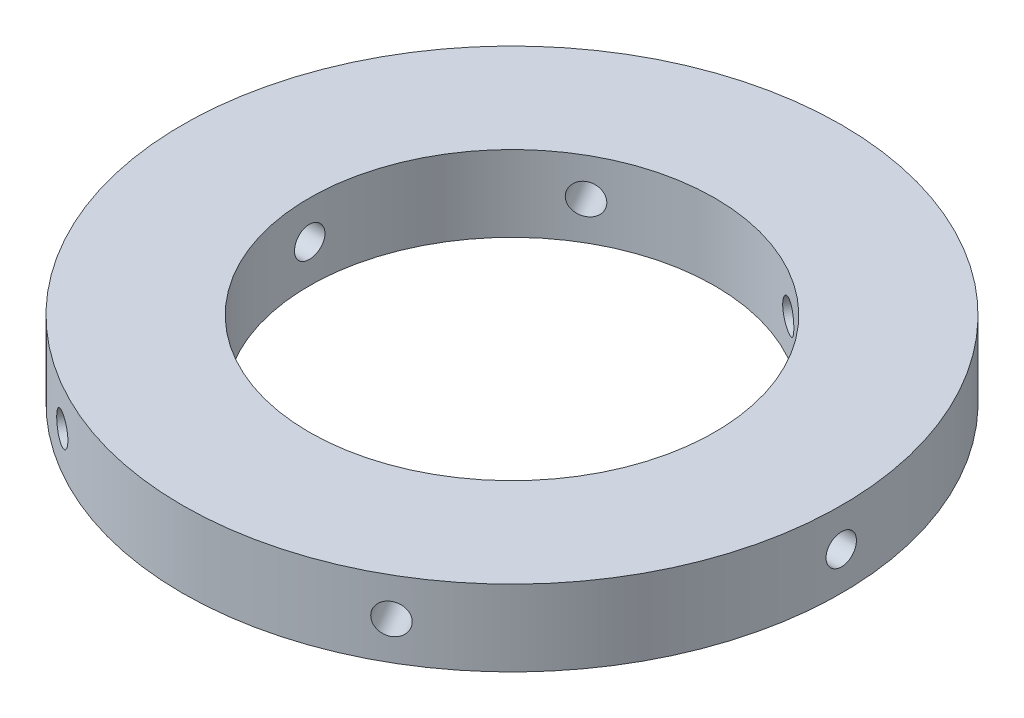
from build123d import *

# Parameters (mm, degrees)
SKETCH1_R           = 65
SKETCH1_R_2         = 40
BOSS_EXTRUDE1_DEPTH = 15
SKETCH2_R           = 3
CUT_EXTRUDE1_DEPTH  = 94.139680051
CIRPATTERN1_COUNT   = 6


with BuildPart() as part:
    # Sketch1 → Boss-Extrude1 (new body)
    with BuildSketch(Plane(origin=(0, 0, 0), x_dir=(1, 0, 0), z_dir=(0, 1, 0))):
        with Locations(Location((0, 0, 0), (0, 0, 270))):
            Circle(SKETCH1_R)
        with Locations(Location((0, 0, 0), (0, 0, 270))):
            Circle(SKETCH1_R_2, mode=Mode.SUBTRACT)
    extrude(amount=BOSS_EXTRUDE1_DEPTH)

    # Sketch2 → Cut-Extrude1 (cut, through all)
    with BuildSketch(Plane(origin=(0, 0, 0), x_dir=(0, 0, -1), z_dir=(1, 0, 0))):
        with Locations((0, 7.5)):
            Circle(SKETCH2_R)
    cut_extrude1 = extrude(amount=-CUT_EXTRUDE1_DEPTH, mode=Mode.SUBTRACT)

    # CirPattern1: Cut-Extrude1 ×6 about axis
    cirpattern1_axis = Axis((0, 15, 0), (0, 1, 0))
    for i in range(1, CIRPATTERN1_COUNT):
        add(cut_extrude1.rotate(cirpattern1_axis, i * 360 / CIRPATTERN1_COUNT), mode=Mode.SUBTRACT)


solid = part.part
